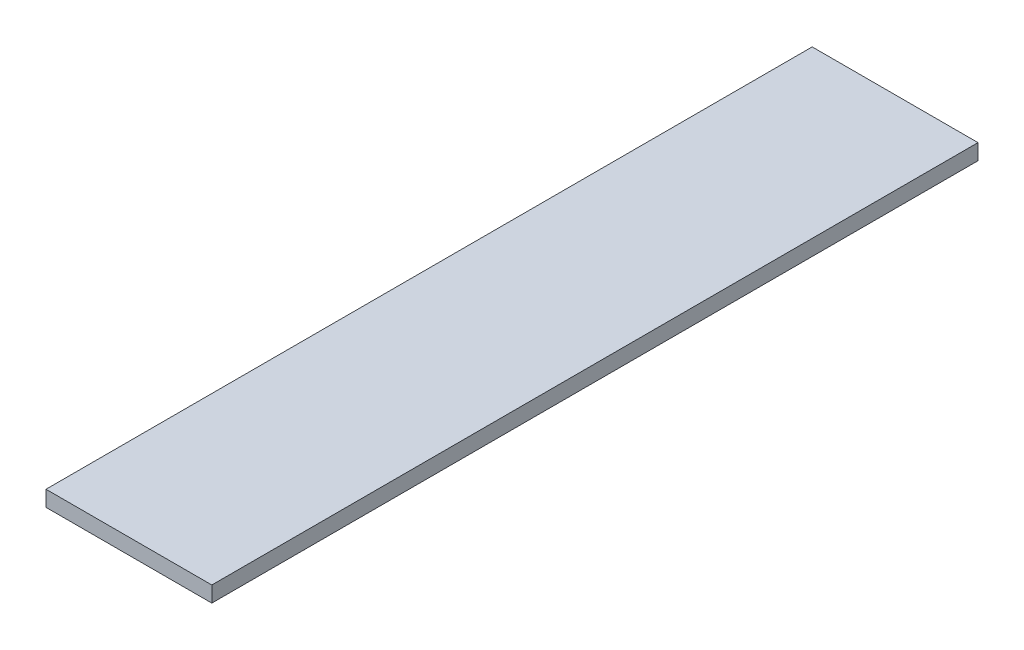
from build123d import *

# Parameters (mm, degrees)
SKETCH1_W           = 184.15
SKETCH1_H           = 17.4498
BOSS_EXTRUDE1_DEPTH = 850.9


with BuildPart() as part:
    # Sketch1 → Boss-Extrude1 (new body)
    with BuildSketch(Plane.XY):
        with Locations((92.075, 8.7249)):
            Rectangle(SKETCH1_W, SKETCH1_H)
    extrude(amount=BOSS_EXTRUDE1_DEPTH)


solid = part.part
